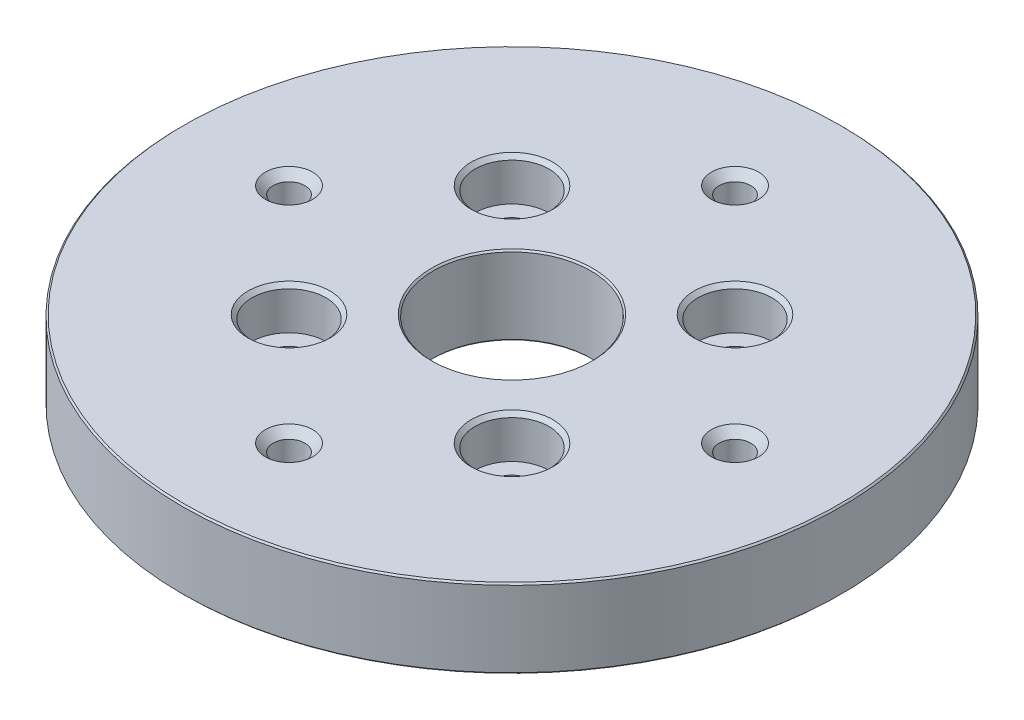
from build123d import *

# Parameters (mm, degrees)
SKETCH1_R                                     = 53.086
SKETCH1_R_2                                   = 12.7
BOSS_EXTRUDE1_DEPTH                           = 12.7
F_1_4_20_TAPPED_HOLE1_AT_2_COUNT              = 2
F_1_4_20_TAPPED_HOLE1_AT_2_PITCH              = 50.8
F_1_4_20_TAPPED_HOLE1_AT_3_COUNT              = 2
F_1_4_20_TAPPED_HOLE1_AT_3_PITCH              = 71.842048969
F_1_4_20_TAPPED_HOLE1_AT_4_COUNT              = 2
F_1_4_20_TAPPED_HOLE1_AT_4_PITCH              = 50.8
CBORE_FOR_1_4_BUTTON_HEAD_CAP_SCREW1_AT_COUNT = 2
CBORE_FOR_1_4_BUTTON_HEAD_CAP_SCREW1_AT_PITCH = 35.921024484
CBORE_FOR_1_4_BUTTON_HEAD_CAP_SCREW1_2_COUNT  = 2
CBORE_FOR_1_4_BUTTON_HEAD_CAP_SCREW1_2_PITCH  = 50.8
CBORE_FOR_1_4_BUTTON_HEAD_CAP_SCREW1_3_COUNT  = 2
CBORE_FOR_1_4_BUTTON_HEAD_CAP_SCREW1_3_PITCH  = 35.921024484
CHAMFER1_SIZE                                 = 0.254


with BuildPart() as part:
    # Sketch1 → Boss-Extrude1 (new body)
    with BuildSketch(Plane(origin=(0, 0, 0), x_dir=(1, 0, 0), z_dir=(0, 1, 0))):
        with Locations(Location((0, 0, 0), (0, 0, 270))):
            Circle(SKETCH1_R)
        with Locations(Location((0, 0, 0), (0, 0, 270))):
            Circle(SKETCH1_R_2, mode=Mode.SUBTRACT)
    extrude(amount=-BOSS_EXTRUDE1_DEPTH)

    # Sketch4 → 1/4-20 Tapped Hole1 (revolve, cut)
    with BuildSketch(Plane(origin=(0, 0, 35.921024484), x_dir=(0, 0, 1), z_dir=(1, 0, 0))):
        Polygon((0, 0), (0, 12.7), (3.81, 12.7), (2.5527, 11.4427), (2.5527, 1.2573), (3.81, 0), align=None)
    f_1_4_20_tapped_hole1 = revolve(axis=Axis((0, 6.35, 35.921024484), (0, -1, 0)), mode=Mode.SUBTRACT)

    # 1/4-20 Tapped Hole1 at 2: 1/4-20 Tapped Hole1 ×2
    with Locations(*[Vector(-0.7071067811865474, 0, -0.7071067811865477) * (i * F_1_4_20_TAPPED_HOLE1_AT_2_PITCH) for i in range(1, F_1_4_20_TAPPED_HOLE1_AT_2_COUNT)]):
        add(f_1_4_20_tapped_hole1, mode=Mode.SUBTRACT)

    # 1/4-20 Tapped Hole1 at 3: 1/4-20 Tapped Hole1 ×2
    with Locations(*[(0, 0, -i * F_1_4_20_TAPPED_HOLE1_AT_3_PITCH) for i in range(1, F_1_4_20_TAPPED_HOLE1_AT_3_COUNT)]):
        add(f_1_4_20_tapped_hole1, mode=Mode.SUBTRACT)

    # 1/4-20 Tapped Hole1 at 4: 1/4-20 Tapped Hole1 ×2
    with Locations(*[Vector(0.7071067811865476, 0, -0.7071067811865475) * (i * F_1_4_20_TAPPED_HOLE1_AT_4_PITCH) for i in range(1, F_1_4_20_TAPPED_HOLE1_AT_4_COUNT)]):
        add(f_1_4_20_tapped_hole1, mode=Mode.SUBTRACT)

    # Sketch5 → CBORE for 1/4 Button Head Cap Screw1 (revolve, cut)
    with BuildSketch(Plane(origin=(-17.960512242, 0, 17.960512242), x_dir=(0, 0, 1), z_dir=(1, 0, 0))):
        Polygon((0, 0), (0, 12.7), (3.8989, 12.7), (3.2639, 12.065), (3.2639, 6.7564), (5.95376, 6.7564), (5.95376, 0.635), (6.58876, 0), align=None)
    cbore_for_1_4_button_head_cap_screw1 = revolve(axis=Axis((-17.960512242, 6.35, 17.960512242), (0, -1, 0)), mode=Mode.SUBTRACT)

    # CBORE for 1/4 Button Head Cap Screw1 at: CBORE for 1/4 Button Head Cap Screw1 ×2
    with Locations(*[(0, 0, -i * CBORE_FOR_1_4_BUTTON_HEAD_CAP_SCREW1_AT_PITCH) for i in range(1, CBORE_FOR_1_4_BUTTON_HEAD_CAP_SCREW1_AT_COUNT)]):
        add(cbore_for_1_4_button_head_cap_screw1, mode=Mode.SUBTRACT)

    # CBORE for 1_4 Button Head Cap Screw1 2: CBORE for 1/4 Button Head Cap Screw1 ×2
    with Locations(*[Vector(0.7071067811865475, 0, -0.7071067811865476) * (i * CBORE_FOR_1_4_BUTTON_HEAD_CAP_SCREW1_2_PITCH) for i in range(1, CBORE_FOR_1_4_BUTTON_HEAD_CAP_SCREW1_2_COUNT)]):
        add(cbore_for_1_4_button_head_cap_screw1, mode=Mode.SUBTRACT)

    # CBORE for 1_4 Button Head Cap Screw1 3: CBORE for 1/4 Button Head Cap Screw1 ×2
    with Locations(*[(i * CBORE_FOR_1_4_BUTTON_HEAD_CAP_SCREW1_3_PITCH, 0, 0) for i in range(1, CBORE_FOR_1_4_BUTTON_HEAD_CAP_SCREW1_3_COUNT)]):
        add(cbore_for_1_4_button_head_cap_screw1, mode=Mode.SUBTRACT)

    # Chamfer1
    chamfer1_edges = [part.edges().sort_by_distance(p)[0] for p in [
        (0, 0, -53.086),
        (0, -12.7, -53.086),
        (0, -12.7, -12.7),
        (0, 0, -12.7),
    ]]
    chamfer(chamfer1_edges, length=CHAMFER1_SIZE)


solid = part.part
